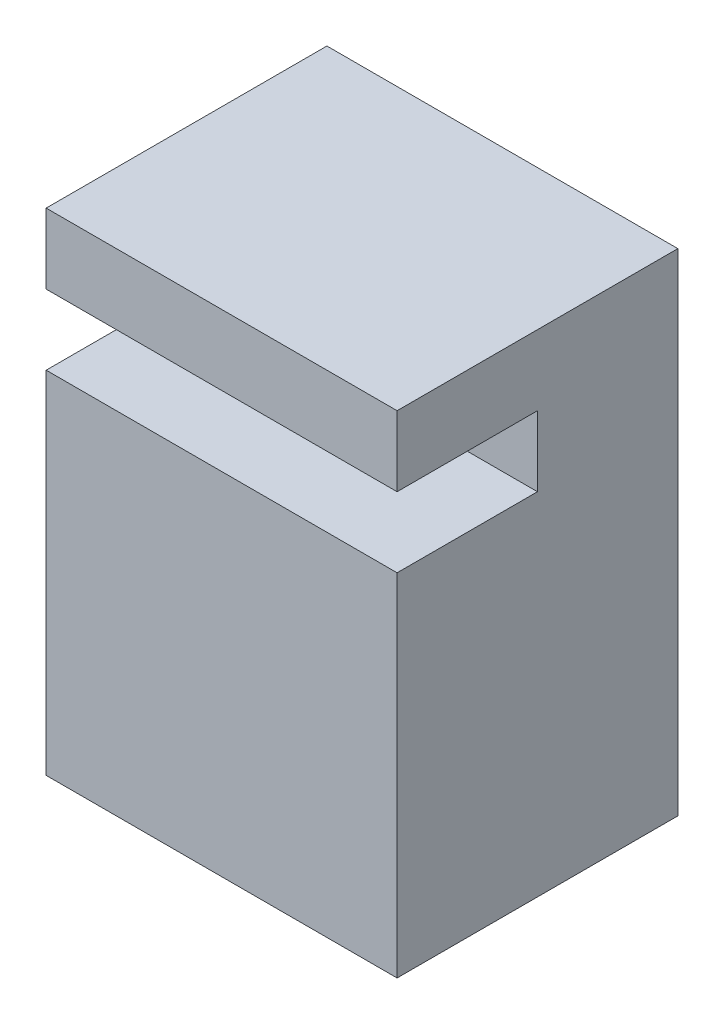
from build123d import *

# Parameters (mm, degrees)
SKETCH1_W           = 50
SKETCH1_H           = 70
BOSS_EXTRUDE1_DEPTH = 40
SKETCH2_W           = 50
SKETCH2_H           = 10
CUT_EXTRUDE1_DEPTH  = 20


with BuildPart() as part:
    # Sketch1 → Boss-Extrude1 (new body)
    with BuildSketch(Plane.XY):
        Rectangle(SKETCH1_W, SKETCH1_H)
    extrude(amount=-BOSS_EXTRUDE1_DEPTH)

    # Sketch2 → Cut-Extrude1 (cut)
    with BuildSketch(Plane.XY):
        with Locations((0, 20)):
            Rectangle(SKETCH2_W, SKETCH2_H)
    extrude(amount=-CUT_EXTRUDE1_DEPTH, mode=Mode.SUBTRACT)


solid = part.part
